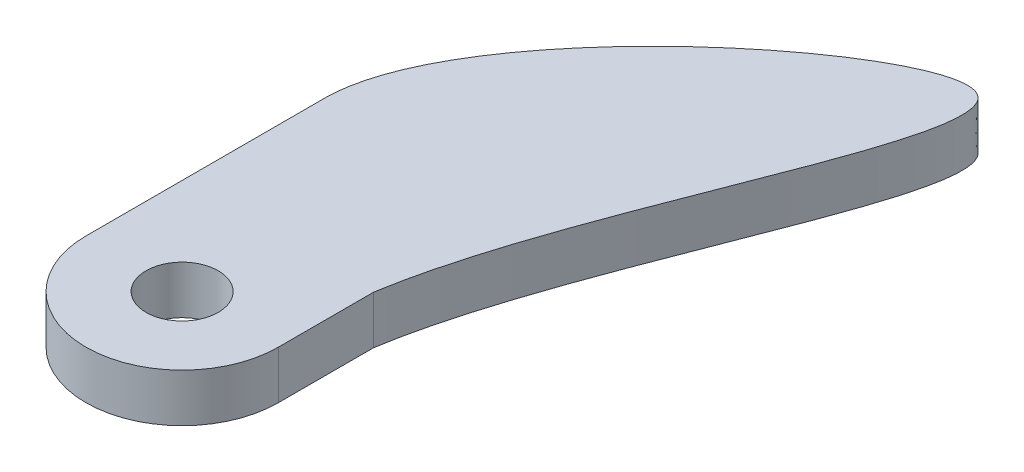
from build123d import *

# Parameters (mm, degrees)
SKETCH_1_R      = 1.5
EXTRUDE_1_DEPTH = 2


with BuildPart() as part:
    # 草图1 → 凸台-拉伸1 (new body)
    with BuildSketch(Plane(origin=(0, 0, 0), x_dir=(1, 0, 0), z_dir=(0, 1, 0))):
        with BuildLine():
            Line((4, 3.957584735), (4, 0))
            ThreePointArc((4, 0), (0, -4), (-4, 0))
            Line((-4, 0), (-4, 10))
            add(Edge.make_bspline(
                [(4, 3.957584735), (5.220328821, 11.617864449), (18.105099326, 33.482498229), (-3.879182843, 15.981547528), (-4, 10)],
                knots=[0.090091428, 0.090091428, 0.090091428, 0.090091428, 0.554982664, 1, 1, 1, 1], degree=3))
        make_face()
        with Locations(Location((0, 0, 0), (0, 0, 270))):
            Circle(SKETCH_1_R, mode=Mode.SUBTRACT)
    extrude(amount=EXTRUDE_1_DEPTH)


solid = part.part
